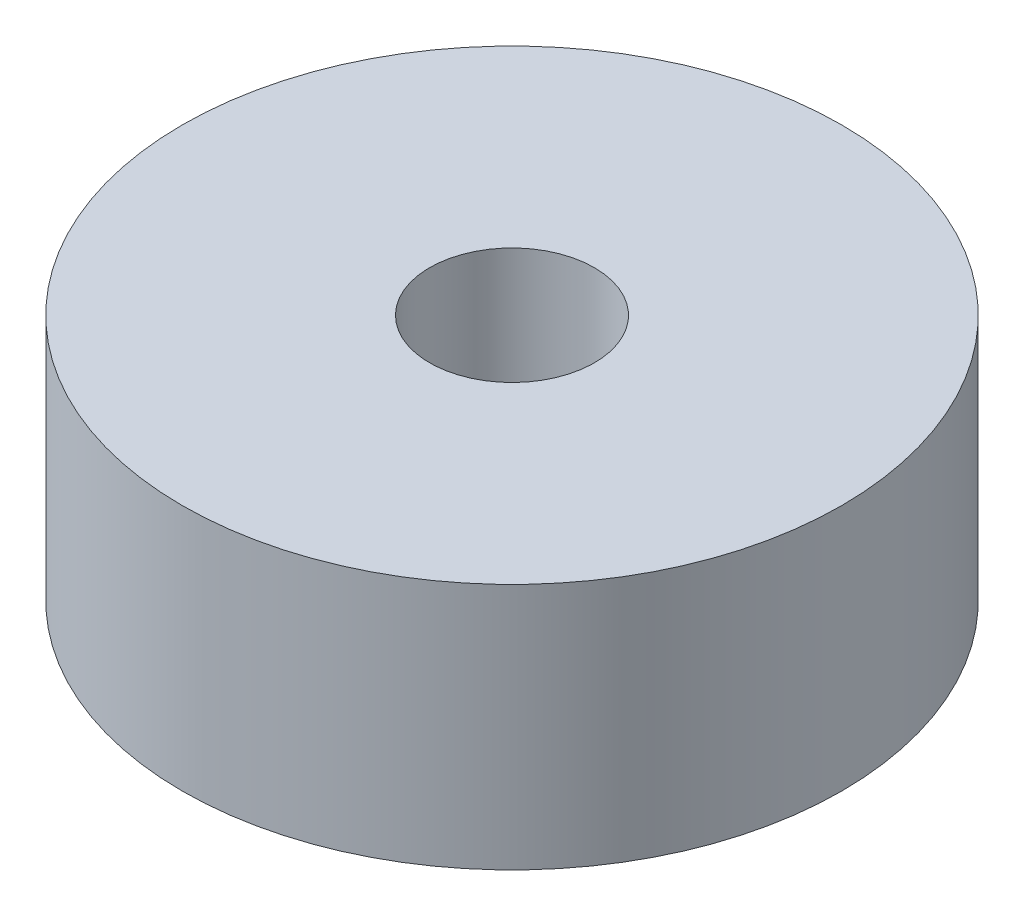
from build123d import *

# Parameters (mm, degrees)
SKETCH_1_W   = 12
SKETCH_1_H   = 12
SKETCH_1_W_2 = 10
SKETCH_1_H_2 = 10


with BuildPart() as part:
    # 草图1 → ThinRevolve360 (revolve)
    with BuildSketch(Plane.XY, mode=Mode.PRIVATE) as thinrevolve360_sk:
        with Locations((10, 5)):
            Rectangle(SKETCH_1_W, SKETCH_1_H)
        with Locations((10, 5)):
            Rectangle(SKETCH_1_W_2, SKETCH_1_H_2, mode=Mode.SUBTRACT)
    revolve(thinrevolve360_sk.sketch.rotate(Axis((0, 0, 0), (0, 1, 0)), 90), axis=Axis((0, 0, 0), (0, 1, 0)))


solid = part.part
